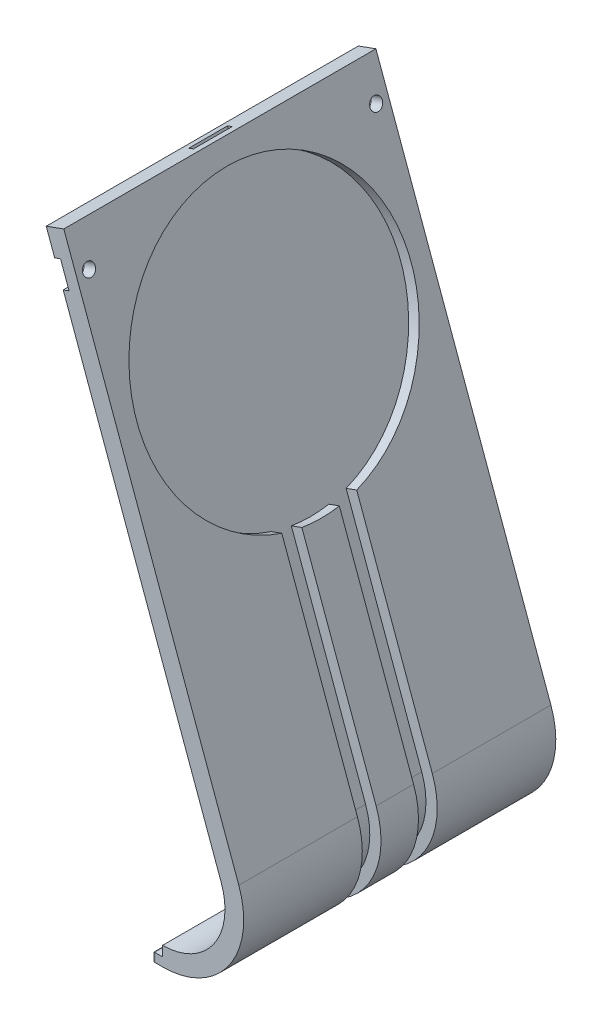
from build123d import *

# Parameters (mm, degrees)
EXTRUDE_1_DEPTH        = 25
SKETCH_4_R             = 22
CUT_EXTRUDE_1_DEPTH    = 1.8
CUT_EXTRUDE_START      = 6
CUT_EXTRUDE_1_2_DEPTH  = 3
SKETCH_11_W            = 18.9
SKETCH_11_H            = 1.4
EXTRUDE_3_DEPTH        = 1.5
FILLET_1_R             = 0.25
SKETCH_12_R            = 1
CUT_EXTRUDE_2623_DEPTH = 91.722501261
CUT_EXTRUDE_1_3_DEPTH  = 1
SKETCH_14_W            = 0.8
SKETCH_14_H            = 6.2
CUT_EXTRUDE_2_DEPTH    = 1


with BuildPart() as part:
    # 草图2 → 整体拉伸-薄壁1 (new, symmetric)
    with BuildSketch(Plane.XY):
        with BuildLine():
            ThreePointArc((28.874192719, 5.049687275), (37.065713162, 9.313922912), (38.271118927, 18.469888708))
            Line((38.271118927, 18.469888708), (10.23281379, 95.504498952))
            Line((10.23281379, 95.504498952), (13.051891653, 96.530559382))
            Line((13.051891653, 96.530559382), (41.090196789, 19.495949138))
            ThreePointArc((41.090196789, 19.495949138), (39.523169295, 7.593193603), (28.874192719, 2.049687275))
            Line((28.874192719, 2.049687275), (28.874192719, 5.049687275))
        make_face()
    extrude(amount=EXTRUDE_1_DEPTH, both=True)

    # 草图4 → Cut-Extrude 1 (cut)
    with BuildSketch(Plane(origin=(42.549434126, 15.486727507, 0), x_dir=(0, 0, -1), z_dir=(0.9396926207859071, 0.3420201433256726, 0))):
        with Locations(Location((0, 60.845044478, 0), (0, 0, 90))):
            Circle(SKETCH_4_R)
    extrude(amount=-CUT_EXTRUDE_1_DEPTH, mode=Mode.SUBTRACT)

    # 草图3 → Cut-Extrude 1 2 (cut)
    with BuildSketch(Plane.XY.offset(CUT_EXTRUDE_START)):
        with BuildLine():
            ThreePointArc((28.874192719, 3.849687275), (38.048695615, 8.625631188), (39.398750072, 18.88031288))
            Line((39.398750072, 18.88031288), (27.572199729, 51.373492899))
            Line((27.572199729, 51.373492899), (26.546139299, 54.192570761))
            Line((26.546139299, 54.192570761), (28.237586016, 54.808207019))
            Line((28.237586016, 54.808207019), (29.263646446, 51.989129157))
            Line((29.263646446, 51.989129157), (41.090196789, 19.495949138))
            ThreePointArc((41.090196789, 19.495949138), (39.523169295, 7.593193603), (28.874192719, 2.049687275))
            Line((28.874192719, 2.049687275), (28.874192719, 3.849687275))
        make_face()
    cut_extrude_1_2 = extrude(amount=-CUT_EXTRUDE_1_2_DEPTH, mode=Mode.SUBTRACT)

    # 镜向1: Cut-Extrude 1 2 across plane
    add(cut_extrude_1_2.mirror(Plane.XY), mode=Mode.SUBTRACT)

    # 草图11 → 底部卡扣凸台-拉伸3 (add)
    with BuildSketch(Plane.ZY.offset(-28.874192719)):
        with Locations((-15.55, 2.749687275)):
            Rectangle(SKETCH_11_W, SKETCH_11_H)
        with Locations((15.55, 2.749687275)):
            Rectangle(SKETCH_11_W, SKETCH_11_H)
    extrude(amount=EXTRUDE_3_DEPTH)

    # 底部卡扣圆角1
    fillet_1_edges = [part.edges().sort_by_distance(p)[0] for p in [
        (27.374192719, 2.749687275, -25),
        (27.374192719, 2.049687275, -15.55),
        (27.374192719, 2.749687275, -6.1),
        (27.374192719, 3.449687275, -15.55),
        (27.374192719, 2.749687275, 6.1),
        (27.374192719, 2.049687275, 15.55),
        (27.374192719, 2.749687275, 25),
        (27.374192719, 3.449687275, 15.55),
    ]]
    fillet(fillet_1_edges, radius=FILLET_1_R)

    # 草图12 → Cut-Extrude 2623 (cut, through all)
    with BuildSketch(Plane(origin=(39.730356264, 14.460667077, 0), x_dir=(0, 0, 1), z_dir=(-0.9396926207859071, -0.3420201433256726, 0))):
        with Locations(Location((23, 80.282840932, 0), (0, 0, 270))):
            Circle(SKETCH_12_R)
        with Locations(Location((-23, 80.282840932, 0), (0, 0, 270))):
            Circle(SKETCH_12_R)
    extrude(amount=-CUT_EXTRUDE_2623_DEPTH, mode=Mode.SUBTRACT)

    # 草图13 → Cut-Extrude 1 3 (cut)
    with BuildSketch(Plane(origin=(39.730356264, 14.460667077, 0), x_dir=(0, 0, 1), z_dir=(-0.9396926207859071, -0.3420201433256726, 0))):
        with BuildLine():
            Line((23, 82.282840932), (25, 82.282840932))
            Line((25, 82.282840932), (25, 78.282840932))
            Line((25, 78.282840932), (23, 78.282840932))
            ThreePointArc((23, 78.282840932), (21, 80.282840932), (23, 82.282840932))
        make_face()
        with BuildLine():
            Line((-25, 82.282840932), (-25, 78.282840932))
            Line((-25, 78.282840932), (-23, 78.282840932))
            ThreePointArc((-23, 78.282840932), (-21, 80.282840932), (-23, 82.282840932))
            Line((-23, 82.282840932), (-25, 82.282840932))
        make_face()
    extrude(amount=-CUT_EXTRUDE_1_3_DEPTH, mode=Mode.SUBTRACT)

    # 草图14 → 切除-拉伸2 (cut)
    with BuildSketch(Plane(origin=(-29.497542473, 81.043831875, 0), x_dir=(0.9396926207859067, 0.3420201433256736, 0), z_dir=(-0.3420201433256736, 0.9396926207859068, 0))):
        with Locations((43.680162028, 0)):
            Rectangle(SKETCH_14_W, SKETCH_14_H)
    extrude(amount=-CUT_EXTRUDE_2_DEPTH, mode=Mode.SUBTRACT)


solid = part.part
